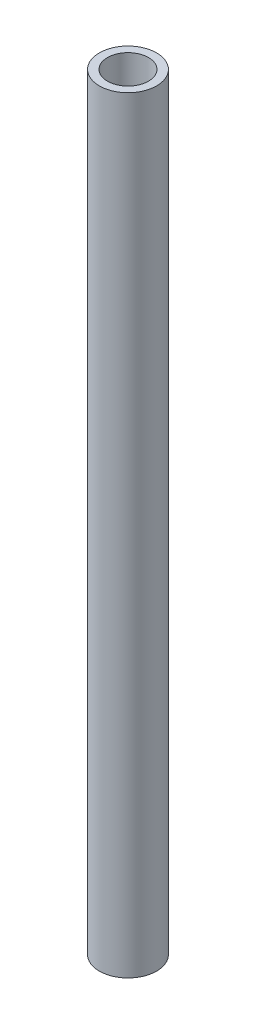
from build123d import *

# Parameters (mm, degrees)
SKETCH1_R           = 10.668
SKETCH1_R_2         = 7.6454
BOSS_EXTRUDE1_DEPTH = 285.75


with BuildPart() as part:
    # Sketch1 → Boss-Extrude1 (new body)
    with BuildSketch(Plane(origin=(0, 0, 0), x_dir=(1, 0, 0), z_dir=(0, 1, 0))):
        with Locations(Location((0, 0, 0), (0, 0, 270))):
            Circle(SKETCH1_R)
        with Locations(Location((0, 0, 0), (0, 0, 270))):
            Circle(SKETCH1_R_2, mode=Mode.SUBTRACT)
    extrude(amount=BOSS_EXTRUDE1_DEPTH)


solid = part.part
